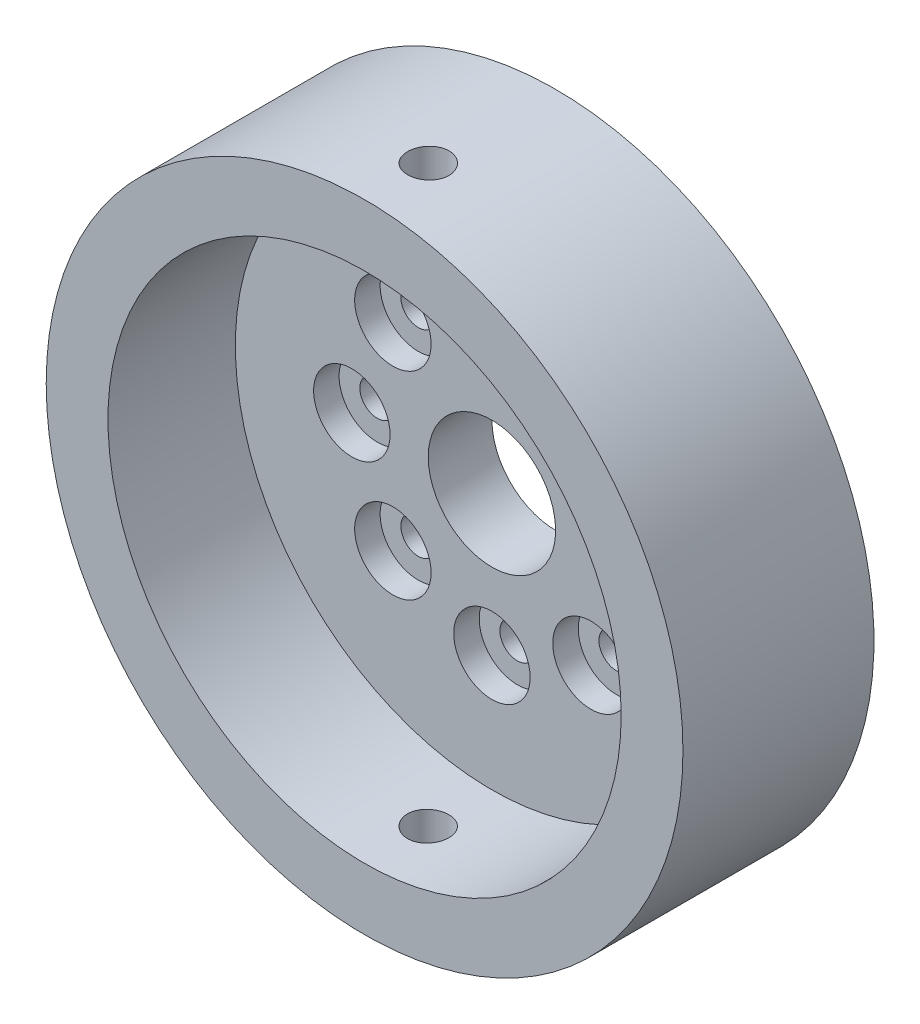
from build123d import *

# Parameters (mm, degrees)
SKETCH1_R               = 25
SKETCH1_R_2             = 20.15
BOSS_EXTRUDE1_DEPTH     = 10
BOSS_EXTRUDE2_START     = 5
SKETCH2_R               = 25
SKETCH2_R_2             = 1.375
SKETCH2_R_3             = 5
BOSS_EXTRUDE2_DEPTH     = 5
SKETCH3_R               = 3
CUT_EXTRUDE1_DEPTH      = 2
CUT_EXTRUDE2_DEPTH      = 38
CUT_EXTRUDE2_DEPTH_BACK = 33
SKETCH4_R               = 1.625


with BuildPart() as part:
    # Sketch1 → Boss-Extrude1 (new body)
    with BuildSketch(Plane.XY):
        Circle(SKETCH1_R)
        Circle(SKETCH1_R_2, mode=Mode.SUBTRACT)
    extrude(amount=BOSS_EXTRUDE1_DEPTH)

    # Sketch2 → Boss-Extrude2 (add)
    with BuildSketch(Plane(origin=(0, 0, 0), x_dir=(-1, 0, 0), z_dir=(0, 0, -1)).offset(BOSS_EXTRUDE2_START)):
        Circle(SKETCH2_R)
        with Locations((-11, 0)):
            Circle(SKETCH2_R_2, mode=Mode.SUBTRACT)
        with Locations((-7.778174593, 7.778174593)):
            Circle(SKETCH2_R_2, mode=Mode.SUBTRACT)
        with Locations((0, 11)):
            Circle(SKETCH2_R_2, mode=Mode.SUBTRACT)
        with Locations((7.778174593, 7.778174593)):
            Circle(SKETCH2_R_2, mode=Mode.SUBTRACT)
        with Locations((11, 0)):
            Circle(SKETCH2_R_2, mode=Mode.SUBTRACT)
        with Locations((7.778174593, -7.778174593)):
            Circle(SKETCH2_R_2, mode=Mode.SUBTRACT)
        with Locations((0, -11)):
            Circle(SKETCH2_R_2, mode=Mode.SUBTRACT)
        with Locations((-7.778174593, -7.778174593)):
            Circle(SKETCH2_R_2, mode=Mode.SUBTRACT)
        Circle(SKETCH2_R_3, mode=Mode.SUBTRACT)
    extrude(amount=-BOSS_EXTRUDE2_DEPTH)

    # Sketch3 → Cut-Extrude1 (cut)
    with BuildSketch(Plane.XY):
        with Locations((0, 11)):
            Circle(SKETCH3_R)
        with Locations((7.778174593, 7.778174593)):
            Circle(SKETCH3_R)
        with Locations((11, 0)):
            Circle(SKETCH3_R)
        with Locations((7.778174593, -7.778174593)):
            Circle(SKETCH3_R)
        with Locations((0, -11)):
            Circle(SKETCH3_R)
        with Locations((-7.778174593, -7.778174593)):
            Circle(SKETCH3_R)
        with Locations((-11, 0)):
            Circle(SKETCH3_R)
        with Locations((-7.778174593, 7.778174593)):
            Circle(SKETCH3_R)
    extrude(amount=-CUT_EXTRUDE1_DEPTH, mode=Mode.SUBTRACT)

    # Sketch4 → Cut-Extrude2 (cut, two sides: drawn at the far end of the back side and taken through both)
    with BuildSketch(Plane(origin=(0, 0, 0), x_dir=(1, 0, 0), z_dir=(0, 1, 0)).offset(-CUT_EXTRUDE2_DEPTH_BACK)):
        with Locations(Location((0, -5, 0), (0, 0, 90))):
            Circle(SKETCH4_R)
    extrude(amount=CUT_EXTRUDE2_DEPTH + CUT_EXTRUDE2_DEPTH_BACK, mode=Mode.SUBTRACT)


solid = part.part
